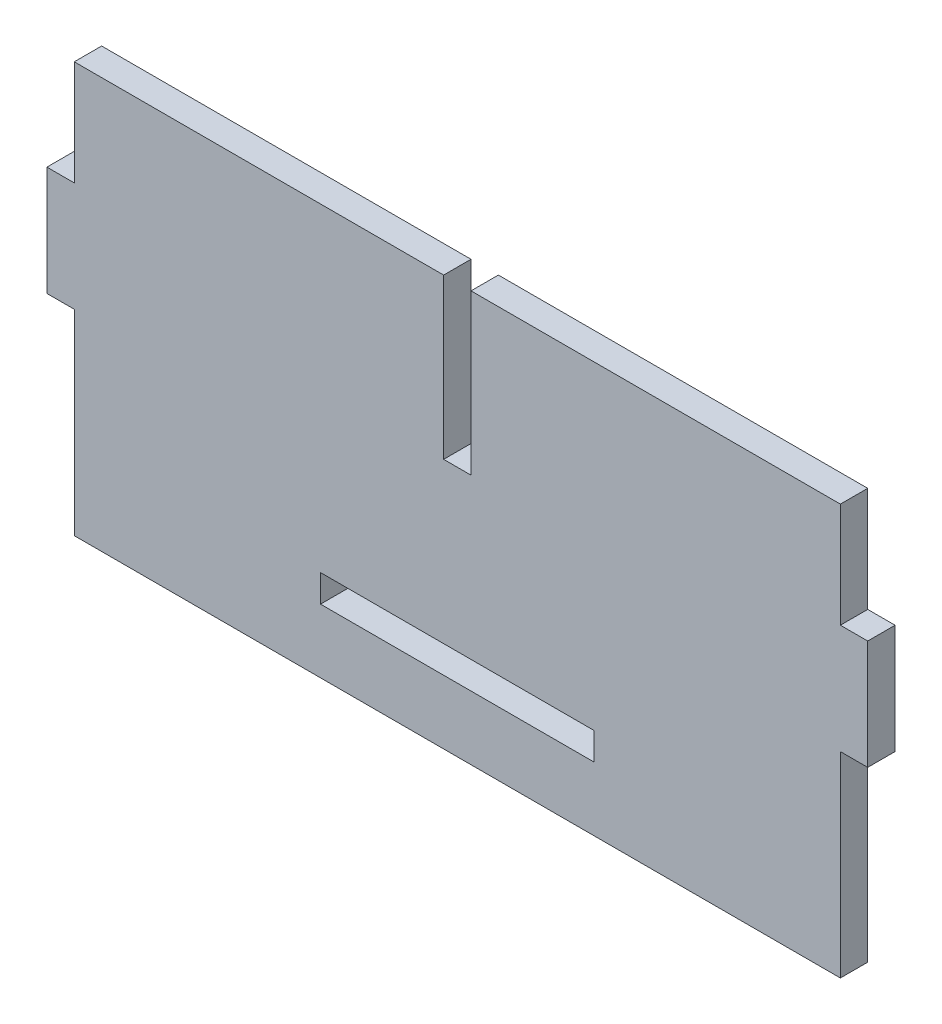
from build123d import *

# Parameters (mm, degrees)
SKETCH1_W           = 30
SKETCH1_H           = 3
BOSS_EXTRUDE1_DEPTH = 3


with BuildPart() as part:
    # Sketch1 → Boss-Extrude1 (new body)
    with BuildSketch(Plane.XY):
        Polygon((-45, 11), (-45, -1), (-42, -1), (-42, -22.5), (42, -22.5), (42, -1), (45, -1), (45, 11), (42, 11), (42, 22.5), (1.5, 22.5), (1.5, 5), (-1.5, 5), (-1.5, 22.5), (-42, 22.5), (-42, 11), align=None)
        with Locations((0, -14)):
            Rectangle(SKETCH1_W, SKETCH1_H, mode=Mode.SUBTRACT)
    extrude(amount=BOSS_EXTRUDE1_DEPTH)


solid = part.part
